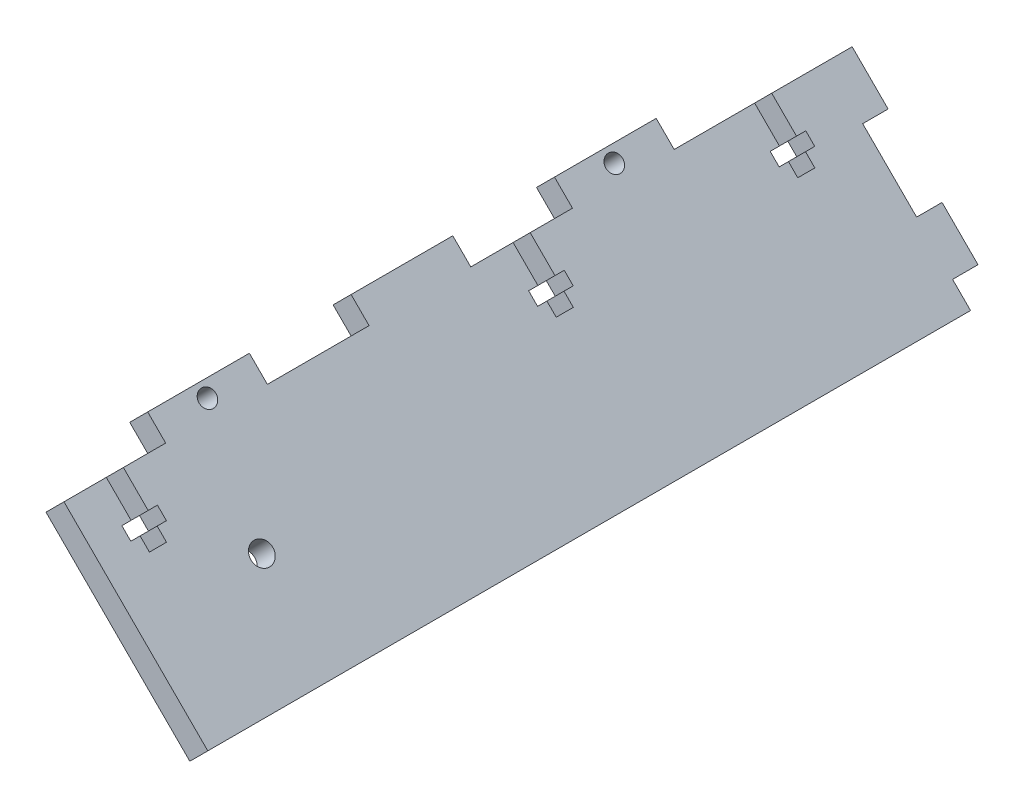
from build123d import *

# Parameters (mm, degrees)
BOSS_EXTRUDE1_DEPTH = 190.5
SKETCH2_W           = 25.4
SKETCH2_H           = 6.35
BOSS_EXTRUDE2_DEPTH = 6.35
LPATTERN1_COUNT     = 3
LPATTERN1_PITCH     = 50.8
BOSS_EXTRUDE3_DEPTH = 6.35
LPATTERN2_COUNT     = 2
LPATTERN2_PITCH     = 31.75
SKETCH4_R           = 2.7305
CUT_EXTRUDE1_DEPTH  = 212.762427449
CUT_EXTRUDE2_DEPTH  = 212.762427449
SKETCH6_R           = 2.0955
CUT_EXTRUDE3_DEPTH  = 212.762427449


with BuildPart() as part:
    # Sketch1 → Boss-Extrude1 (new body)
    with BuildSketch(Plane.XY):
        Polygon((-73.638100193, 43.604904797), (-37.717075708, 7.683880312), (-33.226947648, 12.174008373), (-69.147972132, 48.095032857), align=None)
    extrude(amount=BOSS_EXTRUDE1_DEPTH)

    # Sketch2 → Boss-Extrude2 (add)
    with BuildSketch(Plane(origin=(-58.621502495, 58.621502495, 0), x_dir=(0, 0, 1), z_dir=(-0.7071067811865471, 0.7071067811865479, 0))):
        with Locations((152.4, -18.061676125)):
            Rectangle(SKETCH2_W, SKETCH2_H)
    boss_extrude2 = extrude(amount=BOSS_EXTRUDE2_DEPTH)

    # LPattern1: Boss-Extrude2 ×3
    with Locations(*[(0, 0, -i * LPATTERN1_PITCH) for i in range(1, LPATTERN1_COUNT)]):
        add(boss_extrude2)

    # Sketch3 → Boss-Extrude3 (add)
    with BuildSketch(Plane(origin=(0, 0, 0), x_dir=(-1, 0, 0), z_dir=(0, 0, -1))):
        Polygon((73.638100193, 43.604904797), (64.657844072, 34.624648676), (60.167716011, 39.114776736), (69.147972132, 48.095032857), align=None)
    boss_extrude3 = extrude(amount=BOSS_EXTRUDE3_DEPTH)

    # LPattern2: Boss-Extrude3 ×2
    with Locations(*[Vector(0.7071067811865476, -0.7071067811865476, 0) * (i * LPATTERN2_PITCH) for i in range(1, LPATTERN2_COUNT)]):
        add(boss_extrude3)

    # Sketch4 → Cut-Extrude1 (cut, through all)
    with BuildSketch(Plane(origin=(-10.526469638, -10.526469638, 0), x_dir=(0, 0, -1), z_dir=(0.7071067811865482, 0.7071067811865468, 0))):
        with Locations(Location((-159.0375, 57.503323875, 0), (0, 0, 90))):
            Circle(SKETCH4_R)
    extrude(amount=-CUT_EXTRUDE1_DEPTH, mode=Mode.SUBTRACT)

    # Sketch5 → Cut-Extrude2 (cut, through all)
    with BuildSketch(Plane(origin=(-10.526469638, -10.526469638, 0), x_dir=(0, 0, -1), z_dir=(0.7071067811865487, 0.7071067811865465, 0))):
        Polygon((-175.6664, 82.903323875), (-179.9336, 82.903323875), (-179.9336, 74.140323875), (-182.245, 74.140323875), (-182.245, 70.965323875), (-179.9336, 70.965323875), (-179.9336, 67.663323875), (-175.6664, 67.663323875), (-175.6664, 70.965323875), (-173.355, 70.965323875), (-173.355, 74.140323875), (-175.6664, 74.140323875), align=None)
        Polygon((-74.0664, 82.903323875), (-78.3336, 82.903323875), (-78.3336, 74.140323875), (-80.645, 74.140323875), (-80.645, 70.965323875), (-78.3336, 70.965323875), (-78.3336, 67.663323875), (-74.0664, 67.663323875), (-74.0664, 70.965323875), (-71.755, 70.965323875), (-71.755, 74.140323875), (-74.0664, 74.140323875), align=None)
        Polygon((-13.7414, 82.903323875), (-18.0086, 82.903323875), (-18.0086, 74.140323875), (-20.32, 74.140323875), (-20.32, 70.965323875), (-18.0086, 70.965323875), (-18.0086, 67.663323875), (-13.7414, 67.663323875), (-13.7414, 70.965323875), (-11.43, 70.965323875), (-11.43, 74.140323875), (-13.7414, 74.140323875), align=None)
    extrude(amount=-CUT_EXTRUDE2_DEPTH, mode=Mode.SUBTRACT)

    # Sketch6 → Cut-Extrude3 (cut, through all)
    with BuildSketch(Plane(origin=(-15.016597698, -15.016597698, 0), x_dir=(0, 0, 1), z_dir=(-0.7071067811865486, -0.7071067811865465, 0))):
        with Locations(Location((152.42060291, 86.078323875, 0), (0, 0, 270))):
            Circle(SKETCH6_R)
        with Locations(Location((50.82060291, 86.078323875, 0), (0, 0, 270))):
            Circle(SKETCH6_R)
    extrude(amount=-CUT_EXTRUDE3_DEPTH, mode=Mode.SUBTRACT)


solid = part.part
